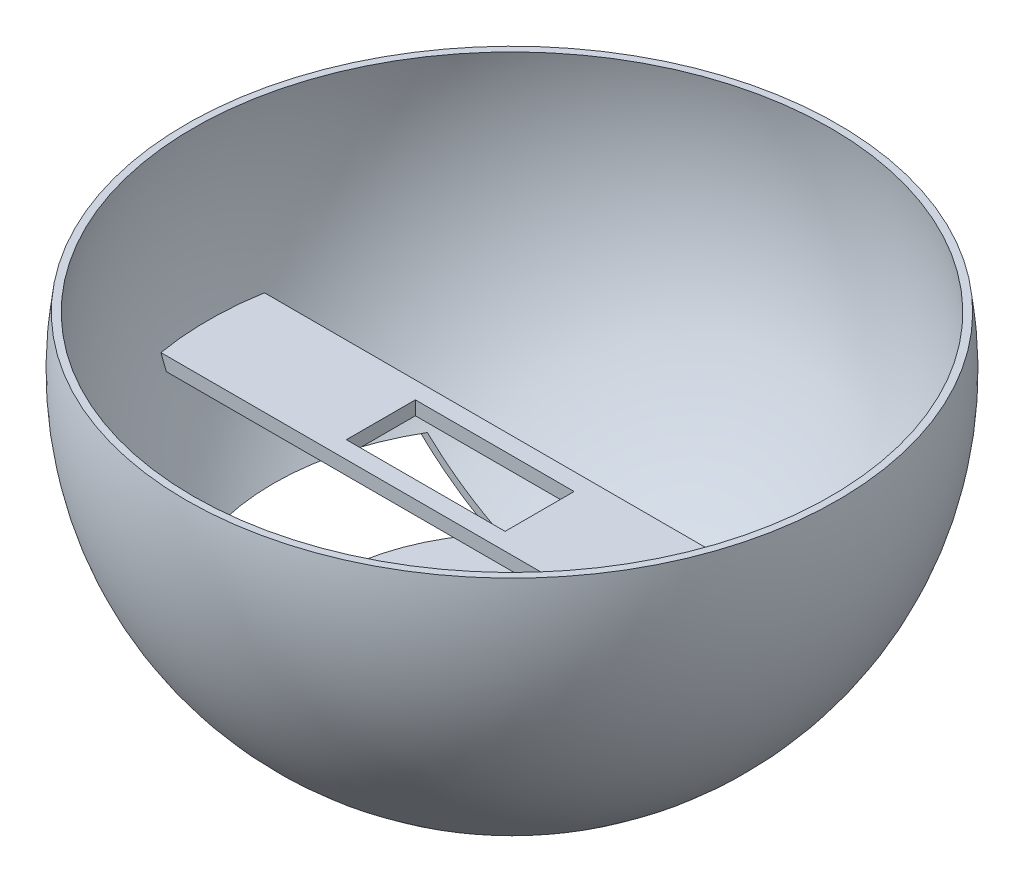
from build123d import *

# Parameters (mm, degrees)
SHELL_1_T            = -1
EXTRUDE_1_REACH      = 80.75
EXTRUDE_1_END_RADIUS = 46.75
SKETCH_2_W           = 15
SKETCH_2_H           = 2
EXTRUDE_2_REACH      = 80.75
SKETCH_4_W           = 15
SKETCH_4_H           = 2
SKETCH_5_W           = 23
SKETCH_5_H           = 10
CUT_EXTRUDE_1_DEPTH  = 10
SKETCH_6_W           = 35
SKETCH_6_H           = 8
CUT_EXTRUDE_2_DEPTH  = 47


with BuildPart() as part:
    # 草图1 → 旋转1 (revolve)
    with BuildSketch(Plane(origin=(0, 0, 0), x_dir=(0, 0, -1), z_dir=(1, 0, 0))):
        with BuildLine():
            Line((-47.200739576, 7.221681487), (0, 7.221681487))
            Line((0, 7.221681487), (0, -40.513710474))
            Line((0, -40.513710474), (-25.272549608, -40.513710474))
            ThreePointArc((-25.272549608, -40.513710474), (-43.390797673, -19.932415241), (-47.200739576, 7.221681487))
        make_face()
    revolve(axis=Axis((0, 7.221681487, 0), (0, -1, 0)))

    # 抽壳1
    shell_1_openings = [part.faces().sort_by_distance(p)[0] for p in [
        (0, 7.221681487, 0),
    ]]
    offset(amount=SHELL_1_T, openings=shell_1_openings, kind=Kind.INTERSECTION)

    # 凸台-拉伸1: up to this sphere (the profile starts inside it)
    extrude_1_end = Location((0, 0, 0)) * Sphere(EXTRUDE_1_END_RADIUS, mode=Mode.PRIVATE)
    # 草图2 → 凸台-拉伸1 (add, up to the surface)
    with BuildSketch(Plane(origin=(0, 0, 0), x_dir=(0, 0, -1), z_dir=(1, 0, 0)), mode=Mode.PRIVATE) as extrude_1_sk1:
        with Locations((0, -16.778318513)):
            Rectangle(SKETCH_2_W, SKETCH_2_H)
    extrude_1_tool1 = extrude(extrude_1_sk1.sketch, amount=EXTRUDE_1_REACH, mode=Mode.PRIVATE) & extrude_1_end
    add(extrude_1_tool1.solids().sort_by_distance((0, -16.778319, 0))[0])

    # 草图4 → 凸台-拉伸2 (add, up to next)
    with BuildSketch(Plane(origin=(0, 0, 0), x_dir=(0, 0, -1), z_dir=(1, 0, 0)), mode=Mode.PRIVATE) as extrude_2_sk1:
        with Locations((0, -16.778318513)):
            Rectangle(SKETCH_4_W, SKETCH_4_H)
    extrude_2_tool1 = extrude(extrude_2_sk1.sketch, amount=-EXTRUDE_2_REACH, mode=Mode.PRIVATE) - part.part
    add(extrude_2_tool1.solids().sort_by_distance((0, -16.778319, 0))[0])

    # 草图5 → 切除-拉伸1 (cut)
    with BuildSketch(Plane(origin=(0, -15.778318513, 0), x_dir=(1, 0, 0), z_dir=(0, 1, 0))):
        with Locations((-7.5, 0)):
            Rectangle(SKETCH_5_W, SKETCH_5_H)
    extrude(amount=-CUT_EXTRUDE_1_DEPTH, mode=Mode.SUBTRACT)

    # 草图6 → 切除-拉伸2 (cut)
    with BuildSketch(Plane(origin=(0, 0, 0), x_dir=(0, 0, -1), z_dir=(1, 0, 0))):
        with Locations((0, -35.513710474)):
            Rectangle(SKETCH_6_W, SKETCH_6_H)
    extrude(amount=-CUT_EXTRUDE_2_DEPTH, mode=Mode.SUBTRACT)


solid = part.part
